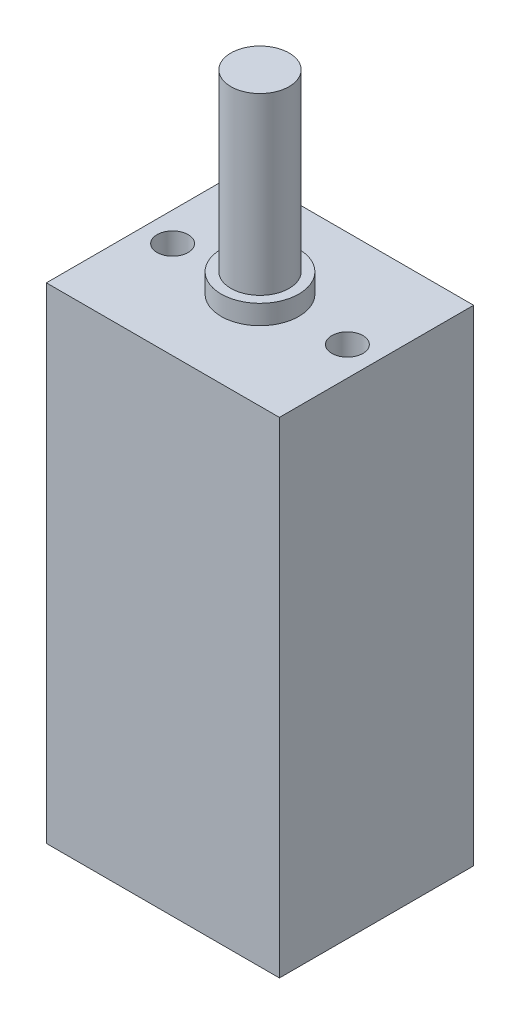
from build123d import *

# Parameters (mm, degrees)
SKETCH_1_W          = 12
SKETCH_1_H          = 10
EXTRUDE_1_DEPTH     = 25
SKETCH_2_R          = 2
EXTRUDE_2_DEPTH     = 1
SKETCH_3_R          = 1.5
EXTRUDE_3_DEPTH     = 9
SKETCH_4_R          = 0.8
CUT_EXTRUDE_1_DEPTH = 5


with BuildPart() as part:
    # 草图1 → 凸台-拉伸1 (new body)
    with BuildSketch(Plane(origin=(0, 0, 0), x_dir=(1, 0, 0), z_dir=(0, 1, 0))):
        Rectangle(SKETCH_1_W, SKETCH_1_H)
    extrude(amount=EXTRUDE_1_DEPTH)

    # 草图2 → 凸台-拉伸2 (add)
    with BuildSketch(Plane(origin=(0, 25, 0), x_dir=(1, 0, 0), z_dir=(0, 1, 0))):
        with Locations(Location((0, 0, 0), (0, 0, 270))):
            Circle(SKETCH_2_R)
    extrude(amount=EXTRUDE_2_DEPTH)

    # 草图3 → 凸台-拉伸3 (add)
    with BuildSketch(Plane(origin=(0, 26, 0), x_dir=(1, 0, 0), z_dir=(0, 1, 0))):
        with Locations(Location((0, 0, 0), (0, 0, 270))):
            Circle(SKETCH_3_R)
    extrude(amount=EXTRUDE_3_DEPTH)

    # 草图4 → 切除-拉伸1 (cut)
    with BuildSketch(Plane(origin=(0, 25, 0), x_dir=(1, 0, 0), z_dir=(0, 1, 0))):
        with Locations(Location((-4.5, 0, 0), (0, 0, 270))):
            Circle(SKETCH_4_R)
        with Locations(Location((4.5, 0, 0), (0, 0, 270))):
            Circle(SKETCH_4_R)
    extrude(amount=-CUT_EXTRUDE_1_DEPTH, mode=Mode.SUBTRACT)


solid = part.part
